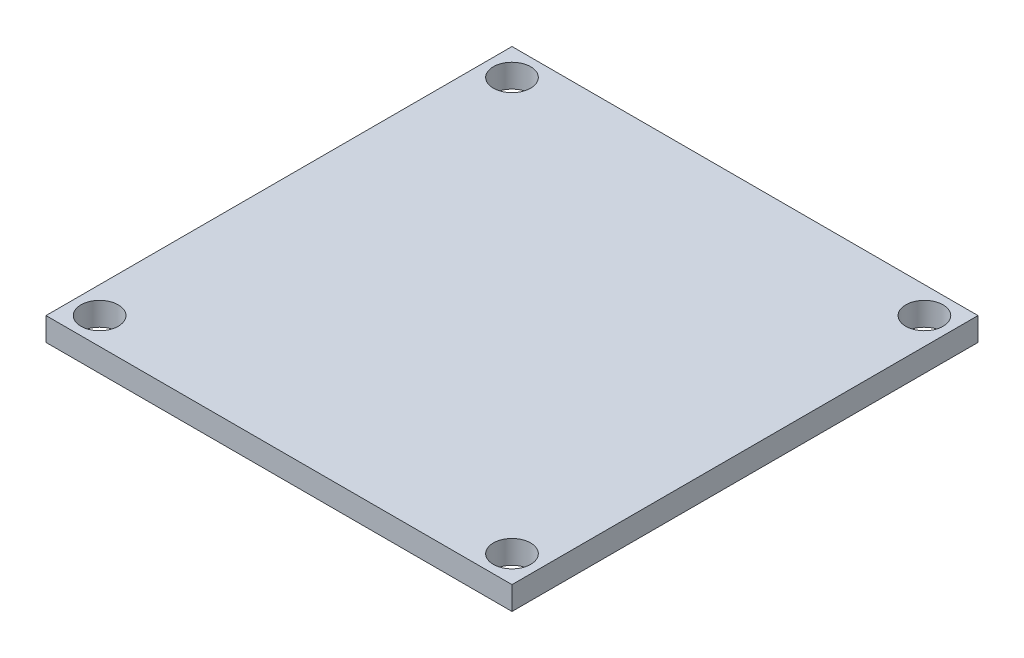
from build123d import *

# Parameters (mm, degrees)
SKETCH1_W           = 40
SKETCH1_H           = 40
BOSS_EXTRUDE1_DEPTH = 2
SKETCH2_R           = 1.6
CUT_EXTRUDE1_DEPTH  = 29.354893758


with BuildPart() as part:
    # Sketch1 → Boss-Extrude1 (new body)
    with BuildSketch(Plane(origin=(0, 0, 0), x_dir=(1, 0, 0), z_dir=(0, 1, 0))):
        Rectangle(SKETCH1_W, SKETCH1_H)
    extrude(amount=BOSS_EXTRUDE1_DEPTH)

    # Sketch2 → Cut-Extrude1 (cut, through all)
    with BuildSketch(Plane(origin=(0, 2, 0), x_dir=(1, 0, 0), z_dir=(0, 1, 0))):
        with Locations(Location((-17.7, 17.7, 0), (0, 0, 270))):
            Circle(SKETCH2_R)
        with Locations(Location((17.7, 17.7, 0), (0, 0, 270))):
            Circle(SKETCH2_R)
        with Locations(Location((17.7, -17.7, 0), (0, 0, 270))):
            Circle(SKETCH2_R)
        with Locations(Location((-17.7, -17.7, 0), (0, 0, 270))):
            Circle(SKETCH2_R)
    extrude(amount=-CUT_EXTRUDE1_DEPTH, mode=Mode.SUBTRACT)


solid = part.part
